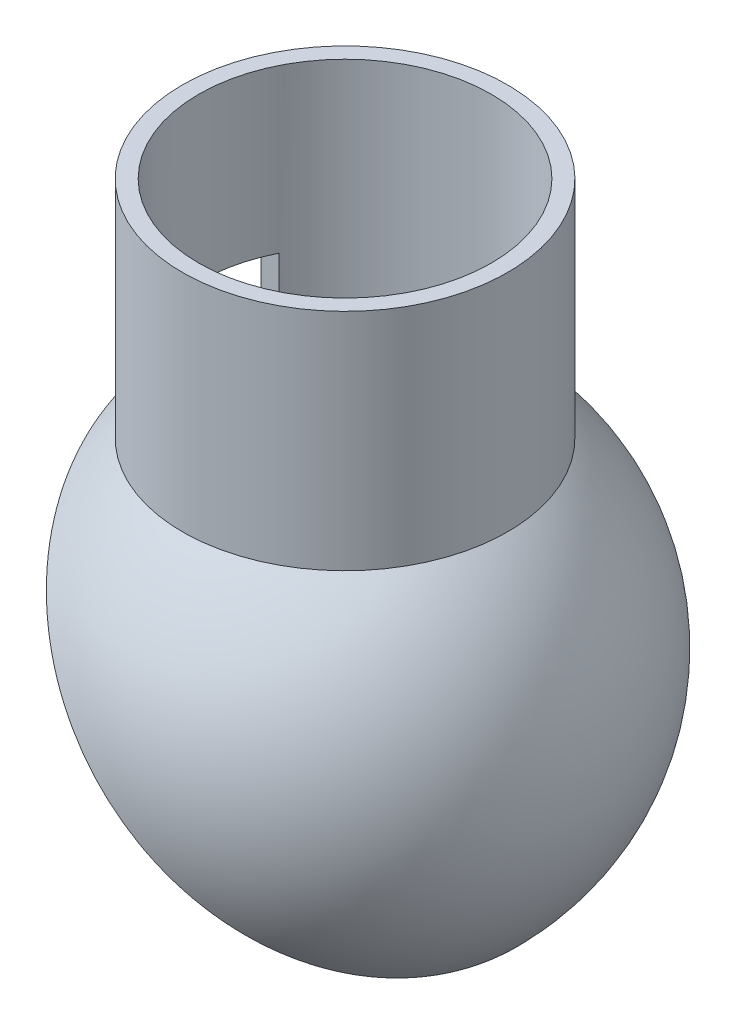
from build123d import *

# Parameters (mm, degrees)
CUT_EXTRUDE_1_DEPTH      = 33.787192622
CUT_EXTRUDE_1_DEPTH_BACK = 33.787192622
SKETCH_5_R               = 9
CUT_EXTRUDE_2_DEPTH      = 15
CUT_EXTRUDE_3_DEPTH      = 14


with BuildPart() as part:
    # 草图1 → 旋转2 (revolve)
    with BuildSketch(Plane.XY):
        with BuildLine():
            Line((-10, 25), (-10, 11.180339887))
            ThreePointArc((-10, 11.180339887), (-14.012585384, -5.352331347), (0, -15))
            Line((0, -15), (0, 25))
            Line((0, 25), (-10, 25))
        make_face()
    revolve(axis=Axis((0, 25, 0), (0, -1, 0)))

    # 草图4 → 切除-拉伸1 (cut, two sides: drawn at the far end of the back side and taken through both)
    with BuildSketch(Plane.XY.offset(-CUT_EXTRUDE_1_DEPTH_BACK)):
        with BuildLine():
            ThreePointArc((10.606601718, -10.606601718), (-10.606601718, -10.606601718), (-10.606601718, 10.606601718))
            Line((-10.606601718, 10.606601718), (0, 0))
            Line((0, 0), (10.606601718, -10.606601718))
        make_face()
    extrude(amount=CUT_EXTRUDE_1_DEPTH + CUT_EXTRUDE_1_DEPTH_BACK, mode=Mode.SUBTRACT)

    # 草图5 → 切除-拉伸2 (cut)
    with BuildSketch(Plane(origin=(0, 25, 0), x_dir=(1, 0, 0), z_dir=(0, 1, 0))):
        with Locations(Location((0, 0, 0), (0, 0, 180))):
            Circle(SKETCH_5_R)
    extrude(amount=-CUT_EXTRUDE_2_DEPTH, mode=Mode.SUBTRACT)

    # 草图6 → 切除-拉伸3 (cut)
    with BuildSketch(Plane(origin=(0, 0, 0), x_dir=(0, 0, -1), z_dir=(1, 0, 0))):
        Polygon((0, 12), (4, 12), (4, 15), (-4, 15), (-4, 12), align=None)
    extrude(amount=-CUT_EXTRUDE_3_DEPTH, mode=Mode.SUBTRACT)


solid = part.part
